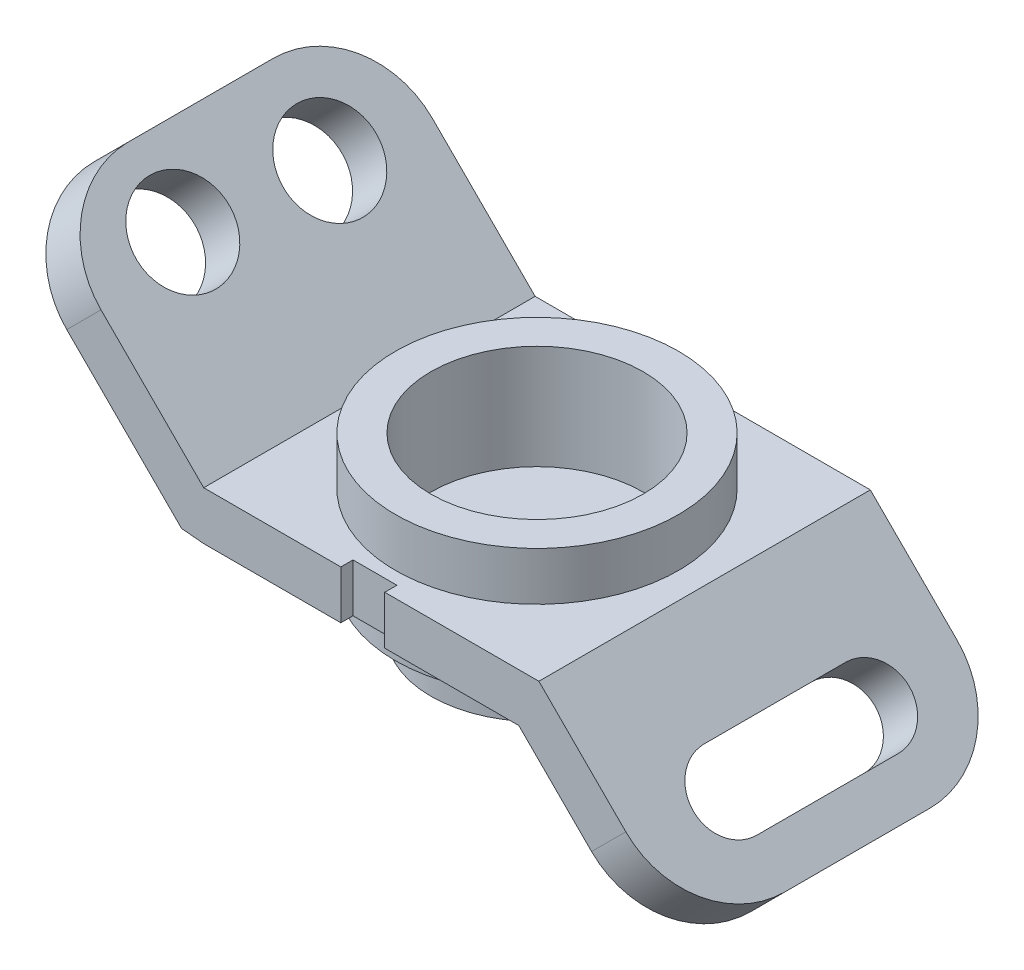
from build123d import *

# Parameters (mm, degrees)
SKETCH_2_W               = 90
SKETCH_2_H               = 89
EXTRUDE_1_DEPTH          = 13
SKETCH_3_W               = 89
SKETCH_3_H               = 58
EXTRUDE_2_DEPTH          = 13
FILLET_1_R               = 25
EXTRUDE_4_DEPTH          = 13
SKETCH_5_R               = 12.5
CUT_EXTRUDE_1_DEPTH      = 134.792817279
FILLET_2_R               = 25
CUT_EXTRUDE_2_DEPTH      = 152.201803843
SKETCH_7_R               = 38
EXTRUDE_5_DEPTH          = 13
CUT_EXTRUDE_3_DEPTH      = 13
CUT_EXTRUDE_3_DEPTH_BACK = 19
SKETCH_7_3_R             = 28.5
EXTRUDE_START            = -13
SKETCH_7_4_R             = 28.5
EXTRUDE_6_DEPTH          = 21
SKETCH_7_5_R             = 12.5
CUT_EXTRUDE_4_DEPTH      = 120.960410109
SKETCH_8_W               = 11.780980298
SKETCH_8_H               = 3.266568958
CUT_EXTRUDE_5_DEPTH      = 21
EXTRUDE_7_DEPTH          = 89
EXTRUDE_START_2          = -21
SKETCH_7_6_R             = 38
EXTRUDE_8_DEPTH          = 21
SKETCH_7_7_R             = 28.5
CUT_EXTRUDE_6_DEPTH      = 15


with BuildPart() as part:
    # 스케치2 → 보스-돌출1 (new body)
    with BuildSketch(Plane(origin=(0, 0, 0), x_dir=(1, 0, 0), z_dir=(0, 1, 0))):
        Rectangle(SKETCH_2_W, SKETCH_2_H)
    extrude(amount=EXTRUDE_1_DEPTH)

    # 스케치3 → 보스-돌출2 (add)
    with BuildSketch(Plane(origin=(29, 29, 0), x_dir=(0, 0, -1), z_dir=(-0.7071067811865438, -0.7071067811865512, 0))):
        with Locations((0, 51.627416998)):
            Rectangle(SKETCH_3_W, SKETCH_3_H)
    extrude(amount=EXTRUDE_2_DEPTH)

    # 필렛1
    fillet_1_edges = [part.edges().sort_by_distance(p)[0] for p in [
        (81.415999231, -32.608387387, -44.5),
        (81.415999231, -32.608387387, 44.5),
    ]]
    fillet(fillet_1_edges, radius=FILLET_1_R)

    # 스케치4 → 보스-돌출4 (add)
    with BuildSketch(Plane(origin=(-16, -16, 0), x_dir=(0, 0, -1), z_dir=(-0.7071067811865438, -0.7071067811865512, 0))):
        Polygon((44.5, -105.012193309), (44.5, -41.012193309), (44.5, -36.415999231), (-44.5, -36.415999231), (-44.5, -41.012193309), (-44.5, -105.012193309), align=None)
    extrude(amount=EXTRUDE_4_DEPTH)

    # 스케치5 → 컷-돌출1 (cut, through all)
    with BuildSketch(Plane(origin=(-16, -16, 0), x_dir=(0, 0, -1), z_dir=(0.707106781186544, 0.7071067811865511, 0))):
        with Locations((-19, 85.012193309)):
            Circle(SKETCH_5_R)
        with Locations((18.938317585, 82.847924647)):
            Circle(SKETCH_5_R)
    extrude(amount=-CUT_EXTRUDE_1_DEPTH, mode=Mode.SUBTRACT)

    # 필렛2
    fillet_2_edges = [part.edges().sort_by_distance(p)[0] for p in [
        (-94.851028074, 53.658639918, -44.5),
        (-94.851028074, 53.658639918, 44.5),
    ]]
    fillet(fillet_2_edges, radius=FILLET_2_R)

    # 스케치6 → 컷-돌출2 (cut, through all)
    with BuildSketch(Plane(origin=(29, 29, 0), x_dir=(0, 0, -1), z_dir=(0.707106781186544, 0.7071067811865511, 0))):
        with BuildLine():
            Line((-18.50653718, -48.627416998), (19.49346282, -48.627416998))
            ThreePointArc((19.49346282, -48.627416998), (29.49346282, -58.627416998), (19.49346282, -68.627416998))
            Line((19.49346282, -68.627416998), (-18.50653718, -68.627416998))
            ThreePointArc((-18.50653718, -68.627416998), (-28.50653718, -58.627416998), (-18.50653718, -48.627416998))
        make_face()
    extrude(amount=-CUT_EXTRUDE_2_DEPTH, mode=Mode.SUBTRACT)

    # 스케치7 → 보스-돌출5 (add)
    with BuildSketch(Plane(origin=(0, 13, 0), x_dir=(1, 0, 0), z_dir=(0, 1, 0))):
        Circle(SKETCH_7_R)
    extrude(amount=EXTRUDE_5_DEPTH)

    # 스케치7<3> → 컷-돌출3 (cut, two sides: drawn at the far end of the back side and taken through both)
    with BuildSketch(Plane(origin=(0, 13, 0), x_dir=(1, 0, 0), z_dir=(0, 1, 0)).offset(-CUT_EXTRUDE_3_DEPTH_BACK)):
        Circle(SKETCH_7_3_R)
    extrude(amount=CUT_EXTRUDE_3_DEPTH + CUT_EXTRUDE_3_DEPTH_BACK, mode=Mode.SUBTRACT)

    # 스케치8 → 컷-돌출5 (cut)
    with BuildSketch(Plane(origin=(0, 13, 0), x_dir=(1, 0, 0), z_dir=(0, 1, 0))):
        with Locations((-2.280738609, 42.866715521)):
            Rectangle(SKETCH_8_W, SKETCH_8_H)
        with Locations((-2.280738609, -42.866715521)):
            Rectangle(SKETCH_8_W, SKETCH_8_H)
    extrude(amount=-CUT_EXTRUDE_5_DEPTH, mode=Mode.SUBTRACT)

    # 스케치9 → 보스-돌출7 (add)
    with BuildSketch(Plane(origin=(0, 0, -44.5), x_dir=(-1, 0, 0), z_dir=(0, 0, -1))):
        Polygon((45, 6.5), (45, 0), (50.942388155, 0.557611845), align=None)
    extrude(amount=-EXTRUDE_7_DEPTH)



with BuildPart() as body_2:
    # 스케치7<4> → 보스-돌출6 (new body)
    with BuildSketch(Plane(origin=(0, 13, 0), x_dir=(1, 0, 0), z_dir=(0, 1, 0)).offset(EXTRUDE_START)):
        Circle(SKETCH_7_4_R)
    extrude(amount=-EXTRUDE_6_DEPTH)

    # 스케치7<5> → 컷-돌출4 (cut, through all)
    with BuildSketch(Plane(origin=(0, 13, 0), x_dir=(1, 0, 0), z_dir=(0, 1, 0))):
        Circle(SKETCH_7_5_R)
    extrude(amount=-CUT_EXTRUDE_4_DEPTH, mode=Mode.SUBTRACT)


with BuildPart() as part_1:
    add(part.part)

    add(body_2.part)  # 보스-돌출8 merges body 2
    # 스케치7<6> → 보스-돌출8 (add)
    with BuildSketch(Plane(origin=(0, 13, 0), x_dir=(1, 0, 0), z_dir=(0, 1, 0)).offset(EXTRUDE_START_2)):
        Circle(SKETCH_7_6_R)
    extrude(amount=EXTRUDE_8_DEPTH)

    # 스케치7<7> → 컷-돌출6 (cut)
    with BuildSketch(Plane(origin=(0, 13, 0), x_dir=(1, 0, 0), z_dir=(0, 1, 0))):
        Circle(SKETCH_7_7_R)
    extrude(amount=-CUT_EXTRUDE_6_DEPTH, mode=Mode.SUBTRACT)


solid = part_1.part
